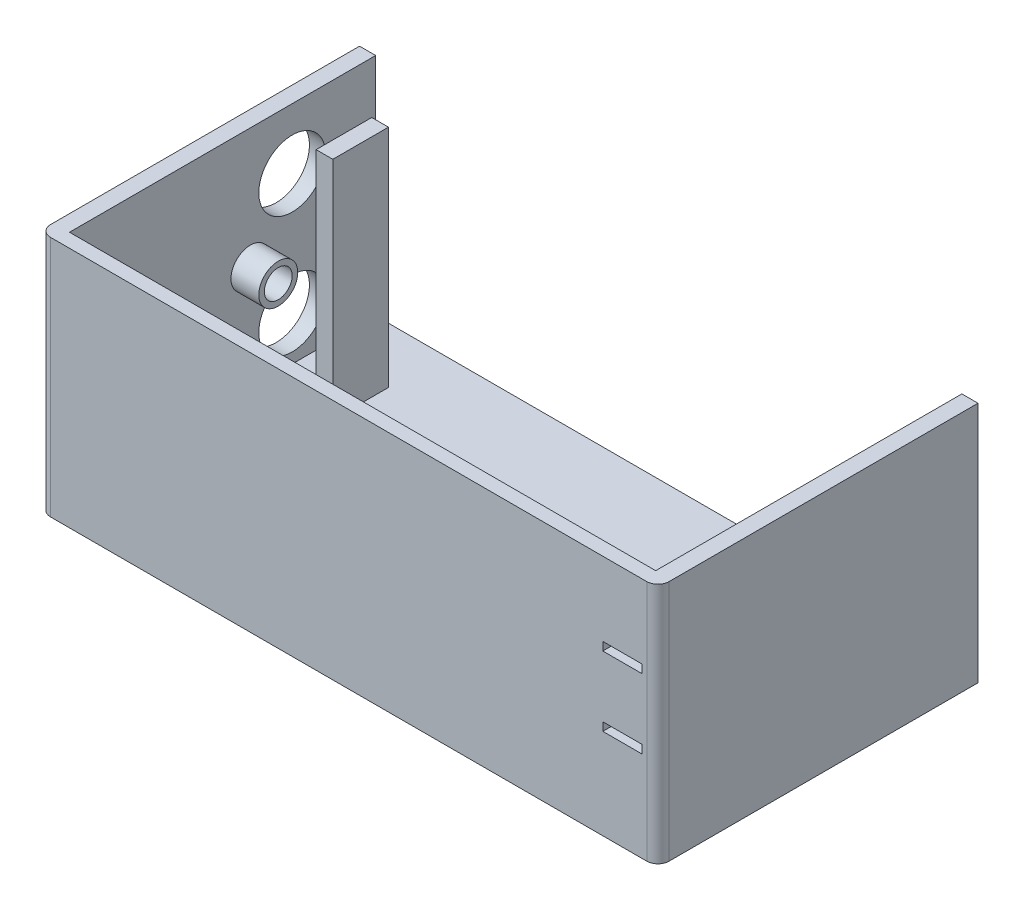
from build123d import *

# Parameters (mm, degrees)
SKETCH1_W            = 111.1
SKETCH1_H            = 60
BOSS_EXTRUDE1_DEPTH  = 3
SKETCH2_W            = 111.1
SKETCH2_H            = 60
SKETCH2_W_2          = 105.3
SKETCH2_H_2          = 55
BOSS_EXTRUDE2_DEPTH  = 40.5
SKETCH5_R            = 21
BOSS_EXTRUDE4_DEPTH  = 15
SKETCH6_W            = 15.5
SKETCH6_H            = 37
CUT_EXTRUDE1_DEPTH   = 21
BOSS_EXTRUDE5_START  = -1
SKETCH8_R            = 21
SKETCH8_W            = 12.3
SKETCH8_H            = 34.3
BOSS_EXTRUDE5_DEPTH  = 1
BOSS_EXTRUDE6_START  = -1
SKETCH9_R            = 21
SKETCH9_W            = 12.3
SKETCH9_H            = 34.3
BOSS_EXTRUDE6_DEPTH  = 1
SKETCH10_W           = 126.244554882
SKETCH10_H           = 68.697179438
CUT_EXTRUDE3_DEPTH   = 53
SKETCH12_W           = 1
SKETCH12_H           = 1.5
BOSS_EXTRUDE8_DEPTH  = 2
FILLET1_R            = 2
SKETCH13_R           = 6
SKETCH13_R_2         = 2.5
CUT_EXTRUDE4_DEPTH   = 14
SKETCH15_W           = 3
SKETCH15_H           = 10
BOSS_EXTRUDE9_DEPTH  = 40.5
SKETCH16_R           = 3.5
CUT_EXTRUDE5_DEPTH   = 1
SKETCH17_W           = 7
SKETCH17_H           = 11
BOSS_EXTRUDE10_DEPTH = 14
SKETCH18_W           = 7
SKETCH18_H           = 1.5
CUT_EXTRUDE6_DEPTH   = 14
SKETCH19_R           = 3.5
SKETCH19_R_2         = 2.5
BOSS_EXTRUDE11_DEPTH = 5


with BuildPart() as part:
    # Sketch1 → Boss-Extrude1 (new body)
    with BuildSketch(Plane(origin=(0, 0, 0), x_dir=(1, 0, 0), z_dir=(0, 1, 0))):
        Rectangle(SKETCH1_W, SKETCH1_H)
    extrude(amount=BOSS_EXTRUDE1_DEPTH)

    # Sketch2 → Boss-Extrude2 (add)
    with BuildSketch(Plane(origin=(0, 3, 0), x_dir=(1, 0, 0), z_dir=(0, 1, 0))):
        Rectangle(SKETCH2_W, SKETCH2_H)
        Rectangle(SKETCH2_W_2, SKETCH2_H_2, mode=Mode.SUBTRACT)
    extrude(amount=BOSS_EXTRUDE2_DEPTH)

    # Sketch5 → Boss-Extrude4 (add)
    with BuildSketch(Plane(origin=(0, 0, -30), x_dir=(-1, 0, 0), z_dir=(0, 0, -1))):
        with Locations((-27.775, 21.75)):
            Circle(SKETCH5_R)
        with Locations(Location((27.775, 21.75, 0), (0, 0, 180))):
            Circle(SKETCH5_R)
    extrude(amount=BOSS_EXTRUDE4_DEPTH)

    # Sketch6 → Cut-Extrude1 (cut)
    with BuildSketch(Plane(origin=(0, 0, -45), x_dir=(-1, 0, 0), z_dir=(0, 0, -1))):
        with Locations((-27.775, 21.75)):
            Rectangle(SKETCH6_W, SKETCH6_H)
        with Locations((27.775, 21.75)):
            Rectangle(SKETCH6_W, SKETCH6_H)
    extrude(amount=-CUT_EXTRUDE1_DEPTH, mode=Mode.SUBTRACT)

    # Sketch8 → Boss-Extrude5 (add)
    with BuildSketch(Plane(origin=(0, 0, -45), x_dir=(-1, 0, 0), z_dir=(0, 0, -1)).offset(BOSS_EXTRUDE5_START)):
        with Locations((-27.775, 21.75)):
            Circle(SKETCH8_R)
        with Locations((-27.775, 21.75)):
            Rectangle(SKETCH8_W, SKETCH8_H, mode=Mode.SUBTRACT)
    extrude(amount=BOSS_EXTRUDE5_DEPTH)

    # Sketch9 → Boss-Extrude6 (add)
    with BuildSketch(Plane(origin=(0, 0, -45), x_dir=(-1, 0, 0), z_dir=(0, 0, -1)).offset(BOSS_EXTRUDE6_START)):
        with Locations(Location((27.775, 21.75, 0), (0, 0, 180))):
            Circle(SKETCH9_R)
        with Locations((27.775, 21.75)):
            Rectangle(SKETCH9_W, SKETCH9_H, mode=Mode.SUBTRACT)
    extrude(amount=BOSS_EXTRUDE6_DEPTH)

    # Sketch10 → Cut-Extrude3 (cut)
    with BuildSketch(Plane.XY.offset(-27.5)):
        with Locations((0, 21.75)):
            Rectangle(SKETCH10_W, SKETCH10_H)
    extrude(amount=-CUT_EXTRUDE3_DEPTH, mode=Mode.SUBTRACT)

    # Sketch12 → Boss-Extrude8 (add)
    with BuildSketch(Plane(origin=(0, 0, -27.5), x_dir=(-1, 0, 0), z_dir=(0, 0, -1))):
        with Locations((52.15, 18.9)):
            Rectangle(SKETCH12_W, SKETCH12_H)
        with Locations((52.15, 7.95)):
            Rectangle(SKETCH12_W, SKETCH12_H)
        with Locations((-52.15, 18.9)):
            Rectangle(SKETCH12_W, SKETCH12_H)
        with Locations((-52.15, 24.6)):
            Rectangle(SKETCH12_W, SKETCH12_H)
        with Locations((52.15, 24.6)):
            Rectangle(SKETCH12_W, SKETCH12_H)
        with Locations((-52.15, 7.95)):
            Rectangle(SKETCH12_W, SKETCH12_H)
    extrude(amount=-BOSS_EXTRUDE8_DEPTH)

    # Fillet1
    fillet1_edges = [part.edges().sort_by_distance(p)[0] for p in [
        (55.55, 21.75, 30),
        (-55.55, 21.75, 30),
    ]]
    fillet(fillet1_edges, radius=FILLET1_R)

    # Sketch13 → Cut-Extrude4 (cut)
    with BuildSketch(Plane(origin=(-52.65, 0, 0), x_dir=(0, 0, -1), z_dir=(1, 0, 0))):
        with Locations((12.5, 32.625)):
            Circle(SKETCH13_R)
        with Locations((12.5, 10.875)):
            Circle(SKETCH13_R)
        with Locations((5, 21.75)):
            Circle(SKETCH13_R_2)
        with BuildLine():
            Line((-25, 25.75), (-27, 25.75))
            ThreePointArc((-27, 25.75), (-27.707106781, 25.457106781), (-28, 24.75))
            Line((-28, 24.75), (-28, 18.75))
            ThreePointArc((-28, 18.75), (-27.707106781, 18.042893219), (-27, 17.75))
            Line((-27, 17.75), (-25, 17.75))
            ThreePointArc((-25, 17.75), (-24.292893219, 18.042893219), (-24, 18.75))
            Line((-24, 18.75), (-24, 24.75))
            ThreePointArc((-24, 24.75), (-24.292893219, 25.457106781), (-25, 25.75))
        make_face()
    extrude(amount=-CUT_EXTRUDE4_DEPTH, mode=Mode.SUBTRACT)

    # Sketch15 → Boss-Extrude9 (add)
    with BuildSketch(Plane(origin=(0, 3, 0), x_dir=(1, 0, 0), z_dir=(0, 1, 0))):
        with Locations((-41.85, 12.5)):
            Rectangle(SKETCH15_W, SKETCH15_H)
    extrude(amount=BOSS_EXTRUDE9_DEPTH)

    # Sketch16 → Cut-Extrude5 (cut)
    with BuildSketch(Plane.ZY.offset(55.55)):
        with Locations((-5, 21.75)):
            Circle(SKETCH16_R)
    extrude(amount=-CUT_EXTRUDE5_DEPTH, mode=Mode.SUBTRACT)

    # Sketch17 → Boss-Extrude10 (add)
    with BuildSketch(Plane(origin=(0, 0, 27.5), x_dir=(-1, 0, 0), z_dir=(0, 0, -1))):
        with Locations((-49.15, 23.25)):
            Rectangle(SKETCH17_W, SKETCH17_H)
    extrude(amount=BOSS_EXTRUDE10_DEPTH)

    # Sketch18 → Cut-Extrude6 (cut)
    with BuildSketch(Plane(origin=(0, 0, 27.5), x_dir=(-1, 0, 0), z_dir=(0, 0, -1))):
        with Locations((-49.15, 29.5)):
            Rectangle(SKETCH18_W, SKETCH18_H)
        with Locations((-49.15, 17)):
            Rectangle(SKETCH18_W, SKETCH18_H)
    extrude(amount=-CUT_EXTRUDE6_DEPTH, mode=Mode.SUBTRACT)

    # Sketch19 → Boss-Extrude11 (add)
    with BuildSketch(Plane(origin=(-52.65, 0, 0), x_dir=(0, 0, -1), z_dir=(1, 0, 0))):
        with Locations(Location((5, 21.75, 0), (0, 0, 180))):
            Circle(SKETCH19_R)
        with Locations((5, 21.75)):
            Circle(SKETCH19_R_2, mode=Mode.SUBTRACT)
    extrude(amount=BOSS_EXTRUDE11_DEPTH)


solid = part.part
